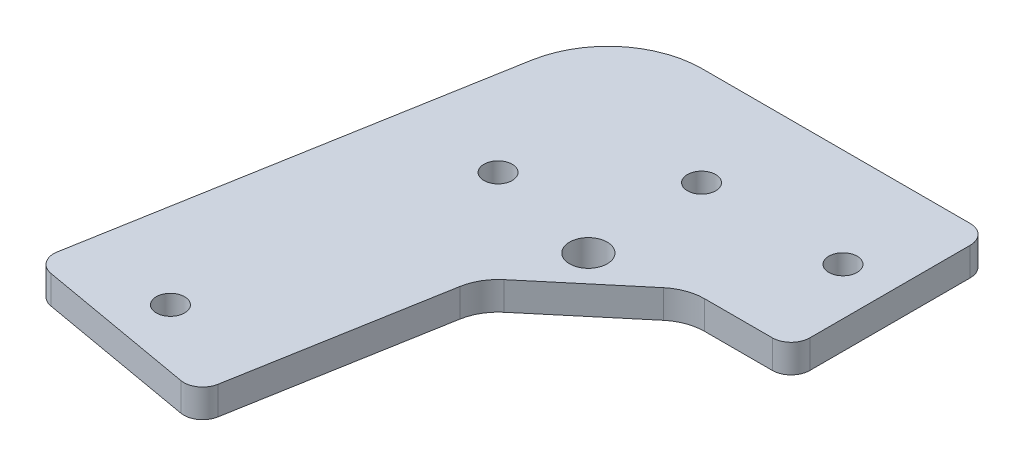
from build123d import *

# Parameters (mm, degrees)
SKETCH_1_R      = 1.5
SKETCH_1_R_2    = 2
EXTRUDE_1_DEPTH = 3
FILLET_1_R      = 2


with BuildPart() as part:
    # 草图1 → 凸台-拉伸1 (new body)
    with BuildSketch(Plane(origin=(0, 0, 0), x_dir=(1, 0, 0), z_dir=(0, 1, 0))):
        with BuildLine():
            Line((30, -10.5), (20.838488019, -10.5))
            ThreePointArc((20.838488019, -10.5), (19.128387303, -10.801536896), (17.624549971, -11.669777784))
            Line((17.624549971, -11.669777784), (8.432016653, -19.383229101))
            ThreePointArc((8.432016653, -19.383229101), (7.315827683, -20.713451316), (6.721915937, -22.345210428))
            Line((6.721915937, -22.345210428), (2.526313412, -46.139654751))
            Line((2.526313412, -46.139654751), (-18.154649402, -42.49304302))
            Line((-18.154649402, -42.49304302), (-10.267627346, 2.236481777))
            ThreePointArc((-10.267627346, 2.236481777), (-6.847425912, 8.160444431), (-0.419549816, 10.5))
            Line((-0.419549816, 10.5), (30, 10.5))
            Line((30, 10.5), (30, -10.5))
        make_face()
        with Locations(Location((25, 0, 0), (0, 0, 270))):
            Circle(SKETCH_1_R, mode=Mode.SUBTRACT)
        with Locations(Location((10, 0, 0), (0, 0, 270))):
            Circle(SKETCH_1_R, mode=Mode.SUBTRACT)
        with Locations(Location((-6.945927107, -39.39231012, 0), (0, 0, 270))):
            Circle(SKETCH_1_R, mode=Mode.SUBTRACT)
        with Locations(Location((-1.736481777, -9.84807753, 0), (0, 0, 270))):
            Circle(SKETCH_1_R, mode=Mode.SUBTRACT)
        with Locations(Location((10.457132873, -12.46232567, 0), (0, 0, 270))):
            Circle(SKETCH_1_R_2, mode=Mode.SUBTRACT)
    extrude(amount=EXTRUDE_1_DEPTH)

    # 圆角1
    fillet_1_edges = [part.edges().sort_by_distance(p)[0] for p in [
        (2.526313412, 1.5, 46.139654751),
        (-18.154649402, 1.5, 42.49304302),
        (30, 1.5, -10.5),
        (30, 1.5, 10.5),
    ]]
    fillet(fillet_1_edges, radius=FILLET_1_R)


solid = part.part
